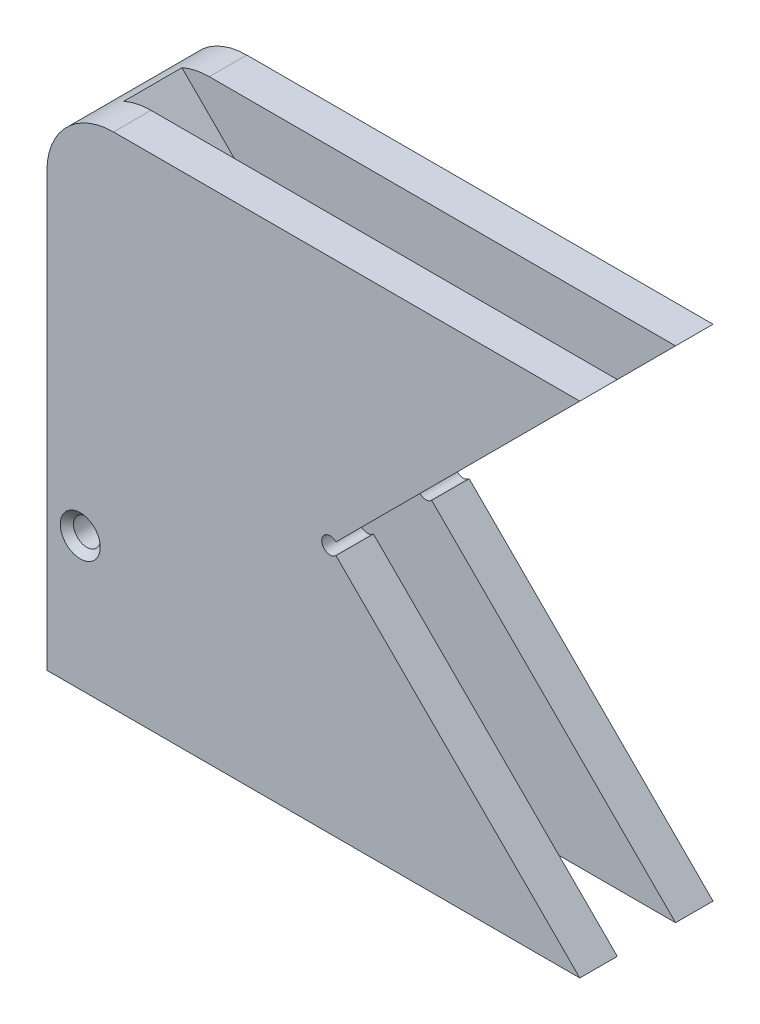
from build123d import *

# Parameters (mm, degrees)
BOSS_EXTRUDE1_DEPTH               = 12.7
F_1_8_0_125_DIAMETER_HOLE1_D      = 3.175
FILLET1_R                         = 12.7
F_1_4_20_TAPPED_HOLE2_D           = 5.1054
F_1_4_20_TAPPED_HOLE2_DEPTH       = 15.875
F_1_4_20_TAPPED_HOLE2_CSINK_D     = 7.62
F_1_4_20_TAPPED_HOLE2_CSINK_ANGLE = 90
F_1_4_20_TAPPED_HOLE2_TIP         = 1.533816902
CUT_EXTRUDE1_DEPTH                = 5.55625


with BuildPart() as part:
    # Sketch2 → Boss-Extrude1 (new, symmetric)
    with BuildSketch(Plane.XY):
        Polygon((0, 0), (0, 95.25), (101.6, 95.25), (53.975, 47.625), (101.6, 0), align=None)
    extrude(amount=BOSS_EXTRUDE1_DEPTH, both=True)

    # 1/8 (0.125) Diameter Hole1 (through all)
    with Locations(Plane.XY.offset(12.7)):
        with Locations((53.975, 47.625)):
            Hole(F_1_8_0_125_DIAMETER_HOLE1_D / 2)

    # Fillet1
    fillet1_edges = [part.edges().sort_by_distance(p)[0] for p in [
        (0, 95.25, 0),
    ]]
    fillet(fillet1_edges, radius=FILLET1_R)

    # Sketch5 → 1/4-20 Tapped Hole1 (revolve, cut)
    with BuildSketch(Plane(origin=(6.35, 25.4, 12.7), x_dir=(0, -1, 0), z_dir=(1, 0, 0))):
        Polygon((0, 0), (0, 25.4), (3.81, 25.4), (2.5527, 24.1427), (2.5527, 1.2573), (3.81, 0), align=None)
    revolve(axis=Axis((6.35, 25.4, 19.05), (0, 0, -1)), mode=Mode.SUBTRACT)

    # 1/4-20 Tapped Hole2
    with Locations(Plane.ZY):
        with Locations((0, 41.275), (0, 9.525)):
            CounterSinkHole(F_1_4_20_TAPPED_HOLE2_D / 2, F_1_4_20_TAPPED_HOLE2_CSINK_D / 2, depth=F_1_4_20_TAPPED_HOLE2_DEPTH, counter_sink_angle=F_1_4_20_TAPPED_HOLE2_CSINK_ANGLE)
            with Locations((0, 0, -(F_1_4_20_TAPPED_HOLE2_DEPTH + F_1_4_20_TAPPED_HOLE2_TIP / 2))):  # 118° drill point
                Cone(0, F_1_4_20_TAPPED_HOLE2_D / 2, F_1_4_20_TAPPED_HOLE2_TIP, mode=Mode.SUBTRACT)

    # Sketch9 → Cut-Extrude1 (cut, symmetric)
    with BuildSketch(Plane.XY):
        Polygon((53.975, 47.625), (101.6, 95.25), (6.35, 95.25), align=None)
        Polygon((101.6, 0), (53.975, 47.625), (6.35, 0), align=None)
    extrude(amount=CUT_EXTRUDE1_DEPTH, both=True, mode=Mode.SUBTRACT)


solid = part.part
